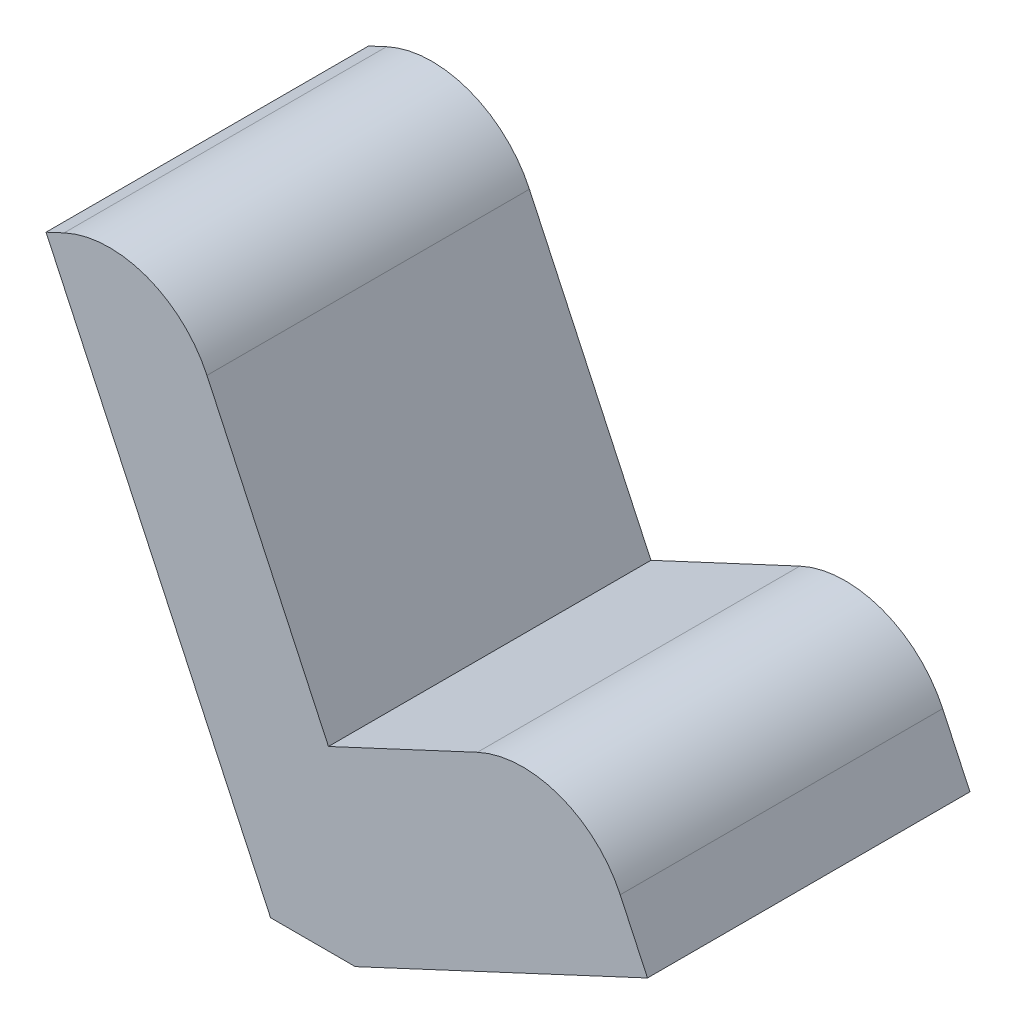
from build123d import *

# Parameters (mm, degrees)
BOSS_EXTRUDE1_DEPTH = 30


with BuildPart() as part:
    # Sketch1 → Boss-Extrude1 (new body)
    with BuildSketch(Plane.XY):
        with BuildLine():
            Line((32.511000358, 16.493407109), (46.364263553, 22.953289827))
            ThreePointArc((46.364263553, 22.953289827), (54.010647604, 23.287138165), (59.653524041, 18.116394574))
            Line((59.653524041, 18.116394574), (60.782415627, 15.695478755))
            Line((60.782415627, 15.695478755), (62.189233611, 12.678547852))
            Line((62.189233611, 12.678547852), (35, 0))
            Line((35, 0), (27.123352817, 0))
            Line((27.123352817, 0), (6.236030424, 44.793007424))
            Line((6.236030424, 44.793007424), (7.915674298, 45.576238226))
            ThreePointArc((7.915674298, 45.576238226), (15.562058348, 45.910086563), (21.204934785, 40.739342973))
            Line((21.204934785, 40.739342973), (32.511000358, 16.493407109))
        make_face()
    extrude(amount=BOSS_EXTRUDE1_DEPTH)


solid = part.part
